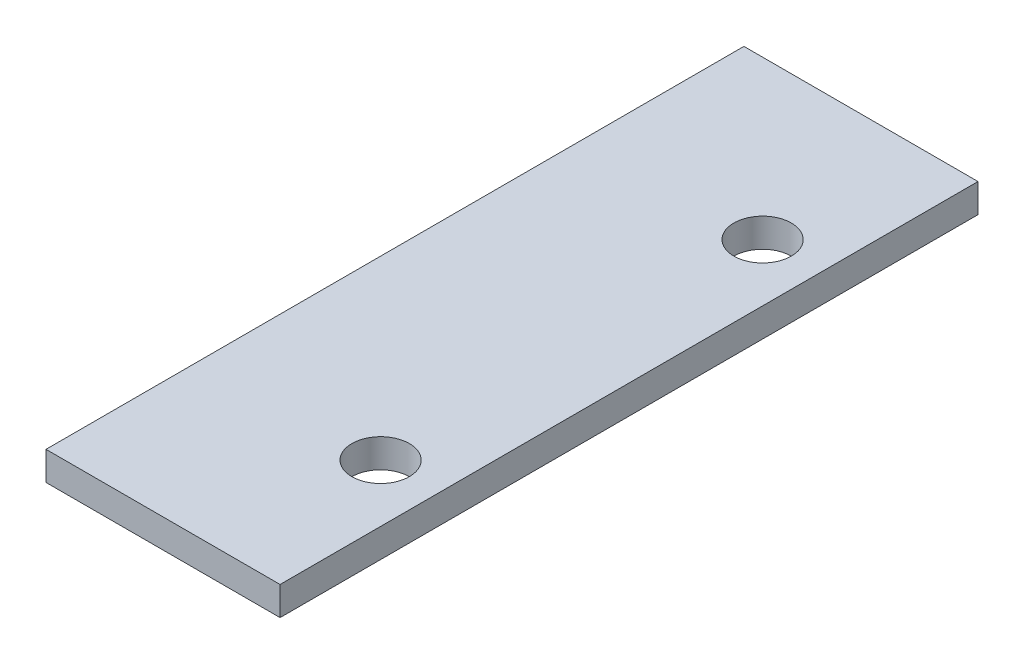
from build123d import *

# Parameters (mm, degrees)
SKETCH1_W           = 16.3
SKETCH1_H           = 48.6
SKETCH1_R           = 2
BOSS_EXTRUDE1_DEPTH = 2


with BuildPart() as part:
    # Sketch1 → Boss-Extrude1 (new body)
    with BuildSketch(Plane(origin=(0, 0, 0), x_dir=(1, 0, 0), z_dir=(0, 1, 0))):
        with Locations((-42.58261944, -19.34371807)):
            Rectangle(SKETCH1_W, SKETCH1_H)
        with Locations(Location((-38.43261944, -6.04371807, 0), (0, 0, 270))):
            Circle(SKETCH1_R, mode=Mode.SUBTRACT)
        with Locations(Location((-38.43261944, -32.64371807, 0), (0, 0, 270))):
            Circle(SKETCH1_R, mode=Mode.SUBTRACT)
    extrude(amount=BOSS_EXTRUDE1_DEPTH)


solid = part.part
